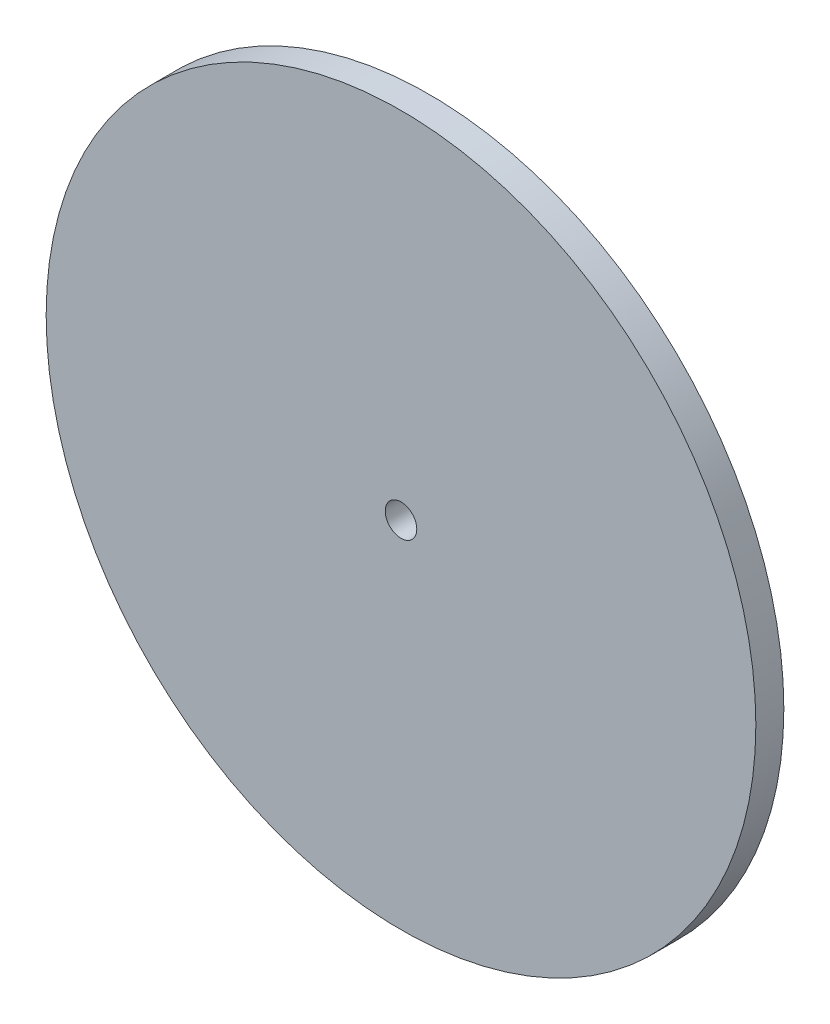
from build123d import *

# Parameters (mm, degrees)
SKETCH1_R           = 45
BOSS_EXTRUDE1_DEPTH = 3.55
SKETCH2_R           = 2
CUT_EXTRUDE1_DEPTH  = 4


with BuildPart() as part:
    # Sketch1 → Boss-Extrude1 (new body)
    with BuildSketch(Plane.XY):
        Circle(SKETCH1_R)
    extrude(amount=BOSS_EXTRUDE1_DEPTH)

    # Sketch2 → Cut-Extrude1 (cut)
    with BuildSketch(Plane.XY.offset(3.55)):
        Circle(SKETCH2_R)
    extrude(amount=-CUT_EXTRUDE1_DEPTH, mode=Mode.SUBTRACT)


solid = part.part
